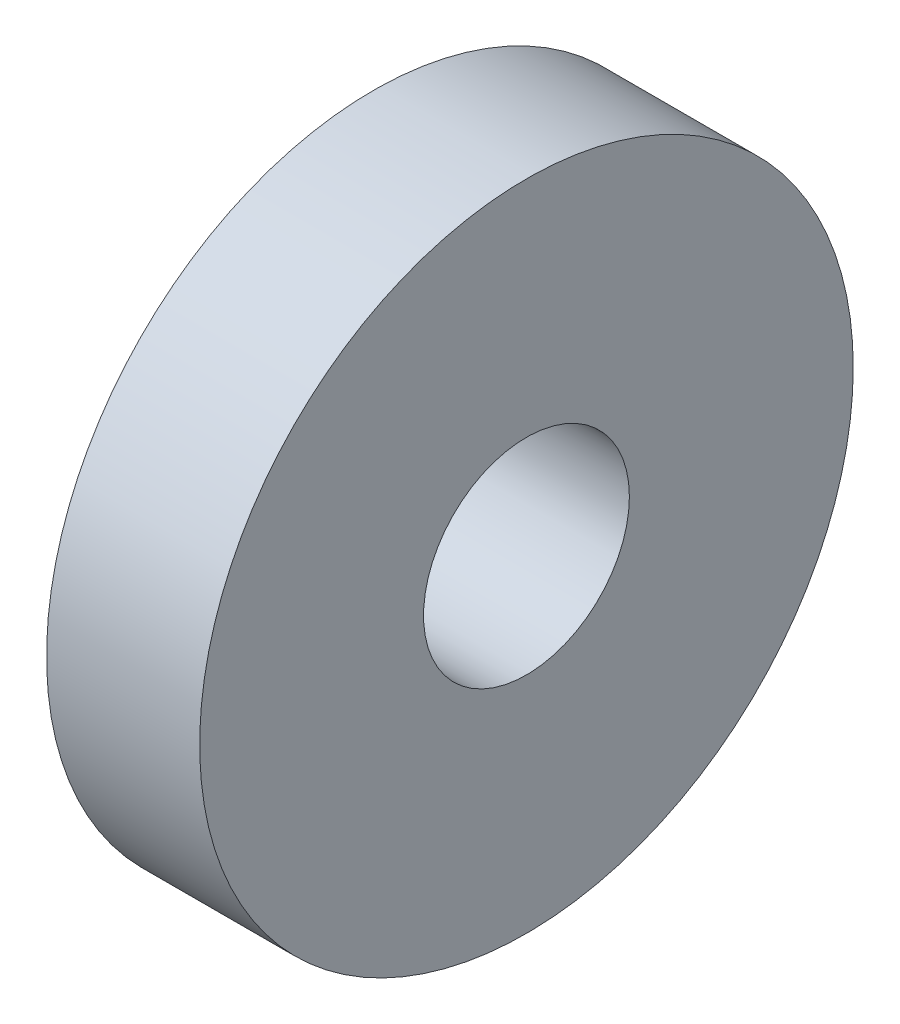
from build123d import *

# Parameters (mm, degrees)
SKETCH1_R           = 6.35
SKETCH1_R_2         = 2
BOSS_EXTRUDE1_DEPTH = 2.975


with BuildPart() as part:
    # Sketch1 → Boss-Extrude1 (new body)
    with BuildSketch(Plane(origin=(0, 0, 0), x_dir=(0, 0, -1), z_dir=(1, 0, 0))):
        Circle(SKETCH1_R)
        Circle(SKETCH1_R_2, mode=Mode.SUBTRACT)
    extrude(amount=BOSS_EXTRUDE1_DEPTH)


solid = part.part
